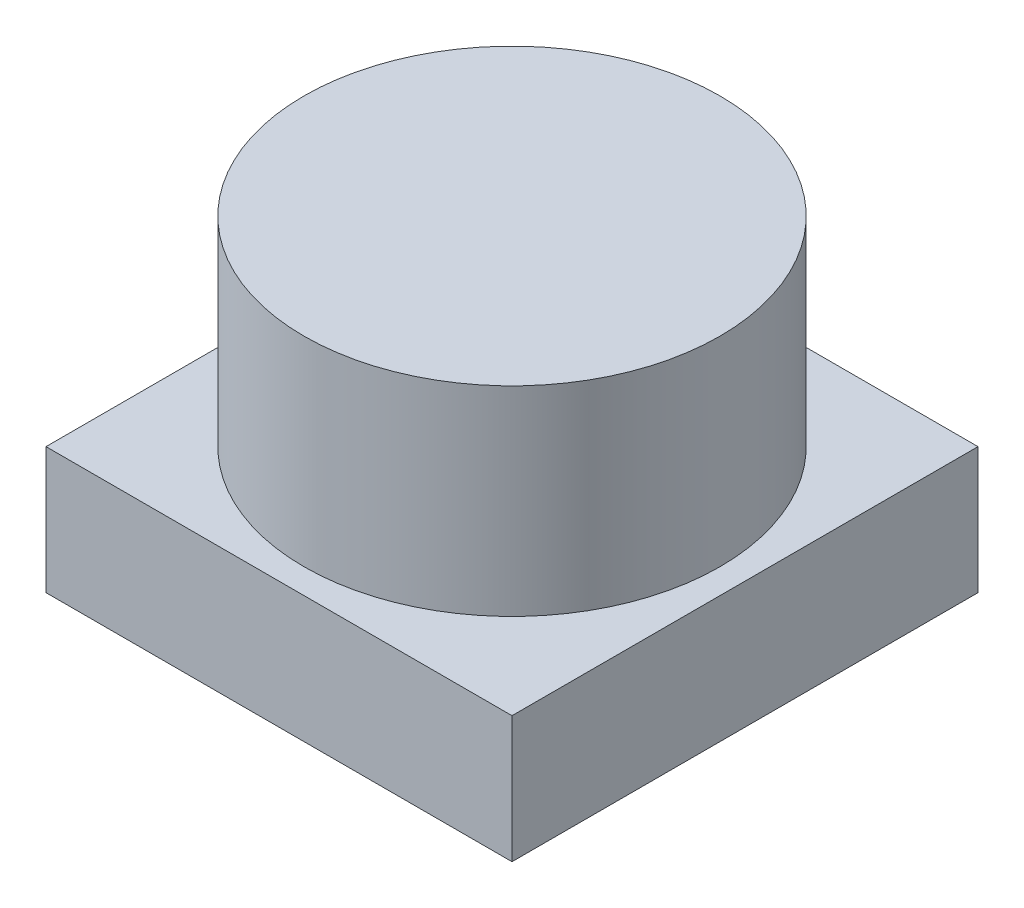
from build123d import *

# Parameters (mm, degrees)
SKETCH1_W           = 7
SKETCH1_H           = 7
BOSS_EXTRUDE1_DEPTH = 1.9
SKETCH2_R           = 3.125
BOSS_EXTRUDE2_DEPTH = 3


with BuildPart() as part:
    # Sketch1 → Boss-Extrude1 (new body)
    with BuildSketch(Plane(origin=(0, 0, 0), x_dir=(1, 0, 0), z_dir=(0, 1, 0))):
        Rectangle(SKETCH1_W, SKETCH1_H)
    extrude(amount=BOSS_EXTRUDE1_DEPTH)

    # Sketch2 → Boss-Extrude2 (add)
    with BuildSketch(Plane(origin=(0, 1.9, 0), x_dir=(1, 0, 0), z_dir=(0, 1, 0))):
        with Locations(Location((0, 0, 0), (0, 0, 270))):
            Circle(SKETCH2_R)
    extrude(amount=BOSS_EXTRUDE2_DEPTH)


solid = part.part
